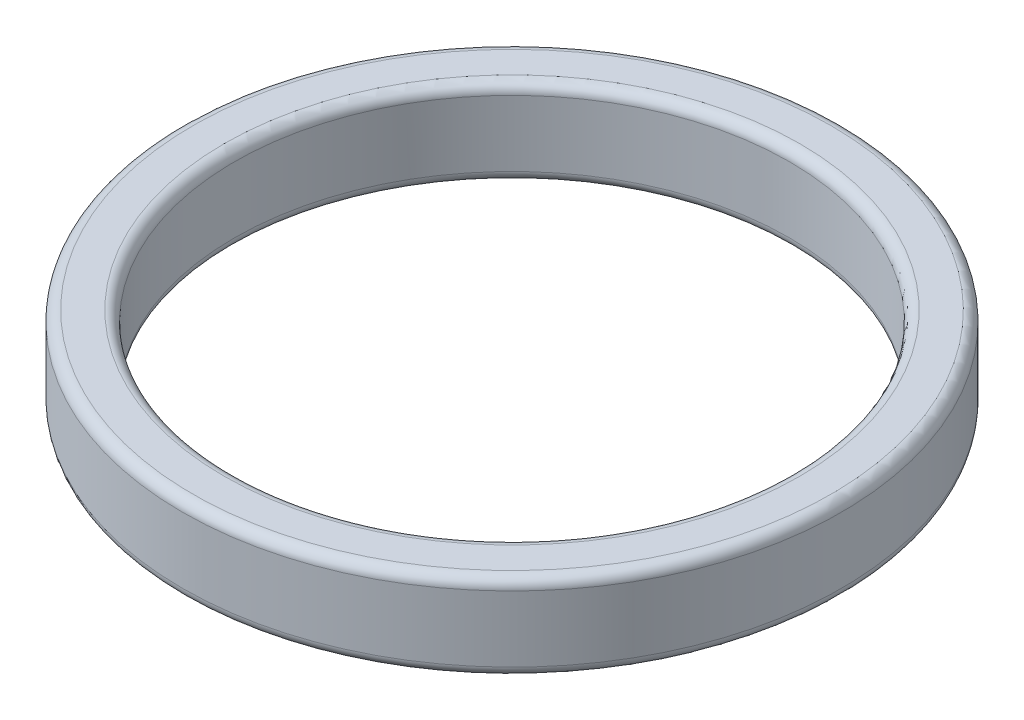
from build123d import *

# Parameters (mm, degrees)
SKETCH_1_W = 1.5
SKETCH_1_H = 2.5
FILLET_1_R = 0.3


with BuildPart() as part:
    # Эскиз1 → Повернуть1 (revolve)
    with BuildSketch(Plane.XY, mode=Mode.PRIVATE) as revolve_1_sk:
        with Locations((-8.75, 1.25)):
            Rectangle(SKETCH_1_W, SKETCH_1_H)
    revolve(revolve_1_sk.sketch.rotate(Axis((0, 0, 0), (0, 1, 0)), 270), axis=Axis((0, 0, 0), (0, 1, 0)))

    # Скругление1
    fillet_1_edges = [part.edges().sort_by_distance(p)[0] for p in [
        (0, 2.5, 9.5),
        (0, 2.5, 8),
        (0, 0, 8),
        (0, 0, 9.5),
    ]]
    fillet(fillet_1_edges, radius=FILLET_1_R)


solid = part.part
